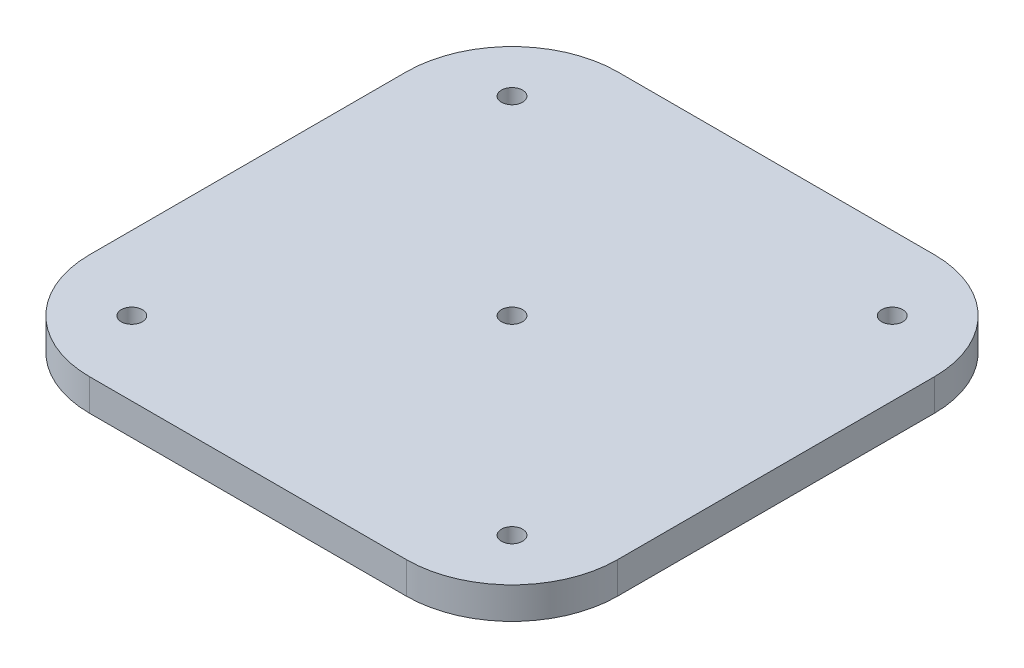
from build123d import *

# Parameters (mm, degrees)
SKETCH_4_R      = 1
EXTRUDE_1_DEPTH = 3


with BuildPart() as part:
    # ｽｹｯﾁ4 → ﾎﾞｽ - 押し出し1 (new body)
    with BuildSketch(Plane(origin=(0, 0, 0), x_dir=(1, 0, 0), z_dir=(0, 1, 0))):
        with BuildLine():
            Line((13.643014387, 25.949889929), (-16.356985613, 25.949889929))
            ThreePointArc((-16.356985613, 25.949889929), (-23.428053425, 23.020957741), (-26.356985613, 15.949889929))
            Line((-26.356985613, 15.949889929), (-26.356985613, -14.050110071))
            ThreePointArc((-26.356985613, -14.050110071), (-23.428053425, -21.121177883), (-16.356985613, -24.050110071))
            Line((-16.356985613, -24.050110071), (13.643014387, -24.050110071))
            ThreePointArc((13.643014387, -24.050110071), (20.714082199, -21.121177883), (23.643014387, -14.050110071))
            Line((23.643014387, -14.050110071), (23.643014387, 15.949889929))
            ThreePointArc((23.643014387, 15.949889929), (20.714082199, 23.020957741), (13.643014387, 25.949889929))
        make_face()
        with Locations(Location((16.643014387, -17.050110071, 0), (0, 0, 270))):
            Circle(SKETCH_4_R, mode=Mode.SUBTRACT)
        with Locations(Location((16.643014387, 18.949889929, 0), (0, 0, 270))):
            Circle(SKETCH_4_R, mode=Mode.SUBTRACT)
        with Locations(Location((-19.356985613, 18.949889929, 0), (0, 0, 270))):
            Circle(SKETCH_4_R, mode=Mode.SUBTRACT)
        with Locations(Location((-19.356985613, -17.050110071, 0), (0, 0, 270))):
            Circle(SKETCH_4_R, mode=Mode.SUBTRACT)
        with Locations(Location((-1.356985613, 0.949889929, 0), (0, 0, 270))):
            Circle(SKETCH_4_R, mode=Mode.SUBTRACT)
    extrude(amount=EXTRUDE_1_DEPTH)


solid = part.part
